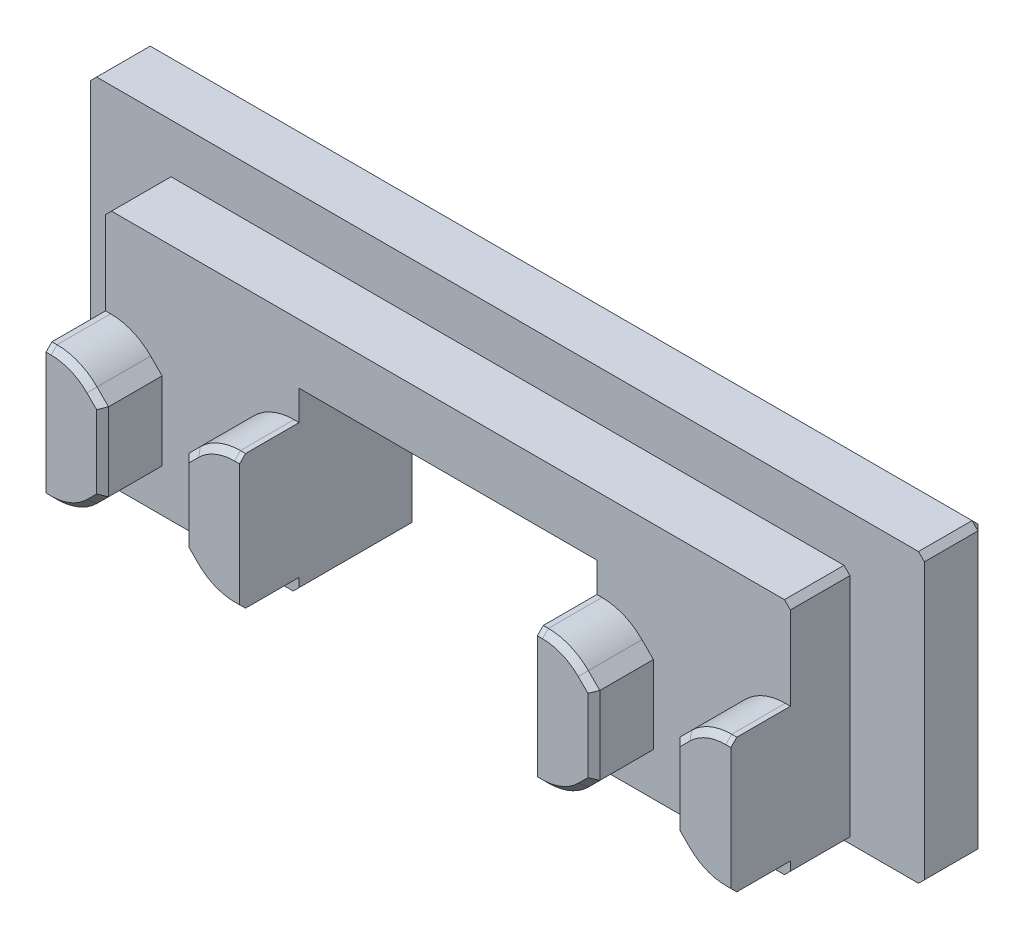
from build123d import *

# Parameters (mm, degrees)
BOSS_EXTRUDE1_DEPTH  = 2
BOSS_EXTRUDE2_DEPTH  = 2
MIRROR2_COPY_1_DEPTH = 2
STOPPER_DEPTH        = 2
STOPPER_DEBURS_SIZE  = 0.2


with BuildPart() as part:
    # Sketch1 → Boss-Extrude1 (new body)
    with BuildSketch(Plane.XY):
        Polygon((-11.5, 4), (11.5, 4), (11.5, -4), (5, -4), (5, 2), (-5, 2), (-5, -4), (-11.5, -4), align=None)
    extrude(amount=-BOSS_EXTRUDE1_DEPTH)

    # Sketch2 → Boss-Extrude2 (add)
    with BuildSketch(Plane.XY):
        with BuildLine():
            Line((11.5, -3.5), (11.5, 1))
            Line((11.5, 1), (11.328427125, 1))
            ThreePointArc((11.328427125, 1), (10.601328603, 0.855371112), (9.98492424, 0.443502884))
            Line((9.98492424, 0.443502884), (9.6, 0.058578644))
            Line((9.6, 0.058578644), (9.6, -2.558578644))
            Line((9.6, -2.558578644), (9.98492424, -2.943502884))
            ThreePointArc((9.98492424, -2.943502884), (10.601328603, -3.355371112), (11.328427125, -3.5))
            Line((11.328427125, -3.5), (11.5, -3.5))
        make_face()
    boss_extrude2 = extrude(amount=BOSS_EXTRUDE2_DEPTH)

    # Mirror1: Boss-Extrude2 across plane
    add(boss_extrude2.mirror(Plane(origin=(8.25, 0, 0), x_dir=(0, 0, 1), z_dir=(1, 0, 0))))

    # Mirror2: Boss-Extrude2 across plane
    add(boss_extrude2.mirror(Plane(origin=(0, 0, 0), x_dir=(0, 0, 1), z_dir=(1, 0, 0))))

    # Mirror2 copy 1 sketch → Mirror2 copy 1 (add)
    with BuildSketch(Plane(origin=(-16.5, 0, 0), x_dir=(1, 0, 0), z_dir=(0, 0, 1))):
        with BuildLine():
            Line((11.5, -3.5), (11.5, 1))
            Line((11.5, 1), (11.328427125, 1))
            ThreePointArc((11.328427125, 1), (10.601328603, 0.855371112), (9.98492424, 0.443502884))
            Line((9.98492424, 0.443502884), (9.6, 0.058578644))
            Line((9.6, 0.058578644), (9.6, -2.558578644))
            Line((9.6, -2.558578644), (9.98492424, -2.943502884))
            ThreePointArc((9.98492424, -2.943502884), (10.601328603, -3.355371112), (11.328427125, -3.5))
            Line((11.328427125, -3.5), (11.5, -3.5))
        make_face()
    extrude(amount=MIRROR2_COPY_1_DEPTH)

    # Sketch4 → Stopper (add)
    with BuildSketch(Plane(origin=(0, 0, -2), x_dir=(-1, 0, 0), z_dir=(0, 0, -1))):
        Polygon((11.5, -4), (14, -4), (14, 5.65), (-14, 5.65), (-14, -4), (-11.5, -4), (-5, -4), (-5, 2), (5, 2), (5, -4), align=None)
    extrude(amount=STOPPER_DEPTH)

    # Stopper Deburs
    stopper_deburs_edges = [part.edges().sort_by_distance(p)[0] for p in [
        (-11.414213562, 1, 2),
        (-11.414213562, -3.5, 2),
        (-10.601328603, -3.355371112, 2),
        (-14, -4, -3),
        (-14, 5.65, -3),
        (14, 5.65, -3),
        (14, -4, -3),
        (-9.5, -4, -4),
        (-14, 0.825, -4),
        (0, 5.65, -4),
        (14, 0.825, -4),
        (9.5, -4, -4),
        (5, -1, -4),
        (0, 2, -4),
        (-5, -1, -4),
        (-11.5, 4, -1),
        (11.5, 4, -1),
        (11.5, -4, -1),
        (5, -4, -2),
        (-5, -4, -2),
        (-11.5, -4, -1),
        (9.79246212, -2.751040764, 2),
        (10.601328603, -3.355371112, 2),
        (11.414213562, -3.5, 2),
        (11.414213562, 1, 2),
        (10.601328603, 0.855371112, 2),
        (9.79246212, 0.251040764, 2),
        (9.6, -1.25, 2),
        (6.70753788, -2.751040764, 2),
        (6.9, -1.25, 2),
        (6.70753788, 0.251040764, 2),
        (5.898671397, 0.855371112, 2),
        (5.085786438, 1, 2),
        (5.085786438, -3.5, 2),
        (5.898671397, -3.355371112, 2),
        (-6.70753788, -2.751040764, 2),
        (-5.898671397, -3.355371112, 2),
        (-5.085786438, -3.5, 2),
        (-5.085786438, 1, 2),
        (-5.898671397, 0.855371112, 2),
        (-6.70753788, 0.251040764, 2),
        (-6.9, -1.25, 2),
        (-9.79246212, -2.751040764, 2),
        (-9.6, -1.25, 2),
        (-9.79246212, 0.251040764, 2),
        (-10.601328603, 0.855371112, 2),
    ]]
    chamfer(stopper_deburs_edges, length=STOPPER_DEBURS_SIZE)


solid = part.part
